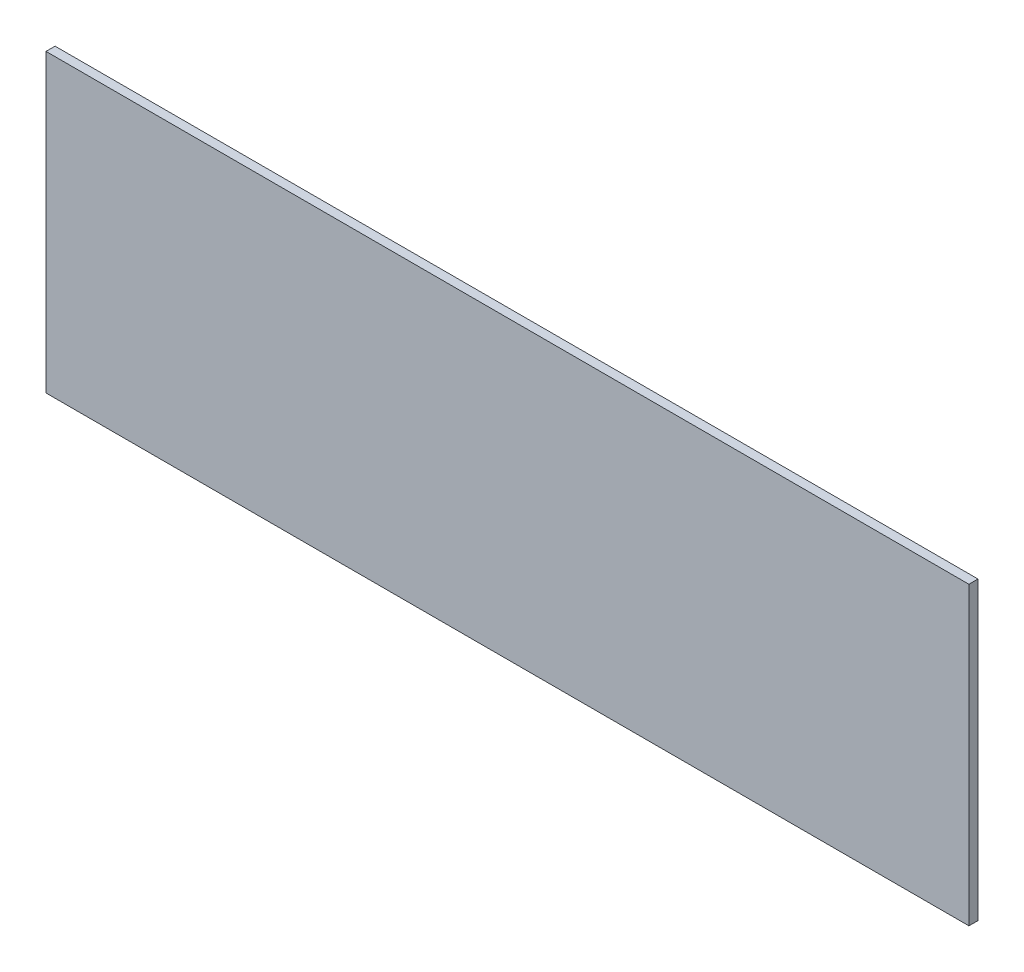
from build123d import *

# Parameters (mm, degrees)
SKETCH_1_W      = 101.646279882
SKETCH_1_H      = 32.582597219
EXTRUDE_1_DEPTH = 1


with BuildPart() as part:
    # 草图1 → 凸台-拉伸1 (new body)
    with BuildSketch(Plane.XY):
        with Locations((2.517280771, 18.313398611)):
            Rectangle(SKETCH_1_W, SKETCH_1_H)
    extrude(amount=EXTRUDE_1_DEPTH)


solid = part.part
